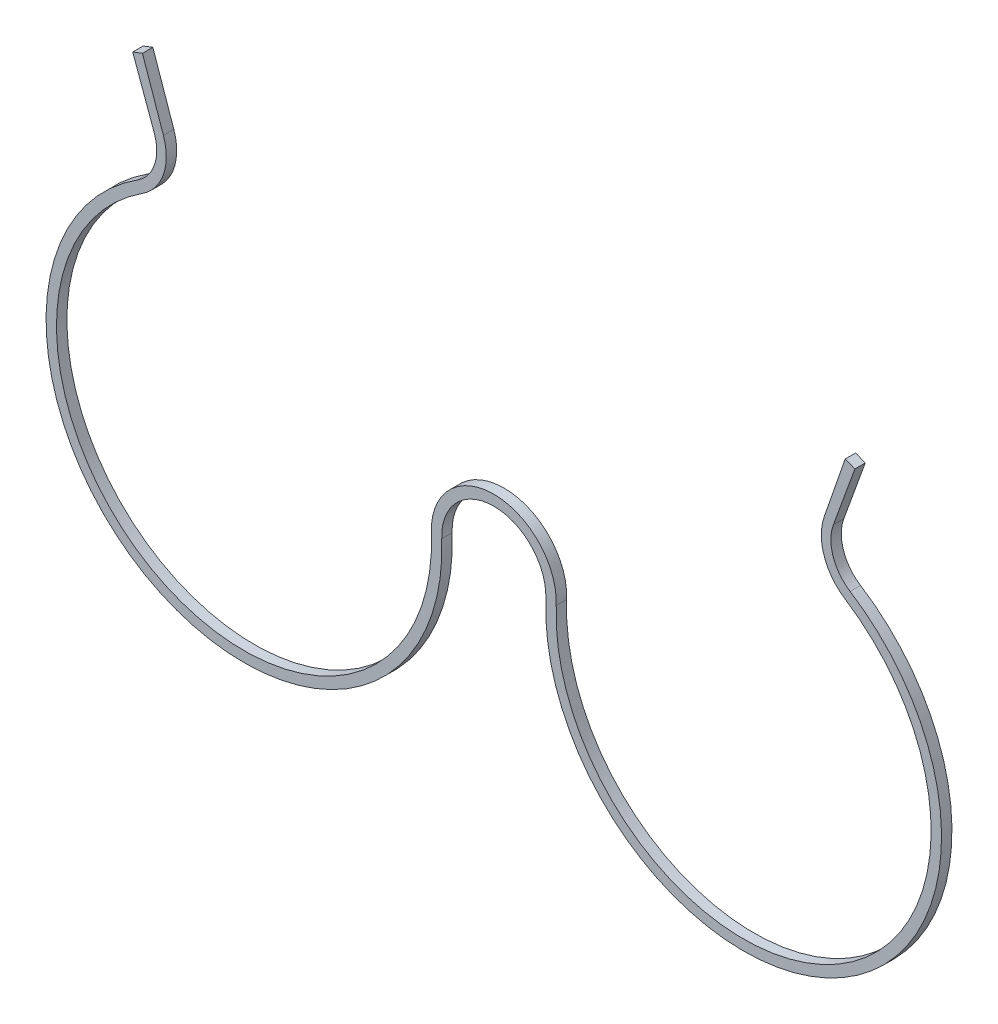
from build123d import *
from build123d.topology import SkipClean

# Parameters (mm, degrees)
BASE_EXTRUSION_DEPTH = 1


with BuildPart() as part:
    # Esquisse2 → Base-Extrusion (new body)
    with BuildSketch(Plane.XY):
        with BuildLine():
            Line((34.681264504, 26.422728636), (32.618025795, 20.754026872))
            ThreePointArc((32.618025795, 20.754026872), (32.588449466, 18.102034919), (34.224309969, 16.014477377))
            ThreePointArc((34.224309969, 16.014477377), (32.781477268, -16.8489067), (5.01650022, 0.791666667))
            ThreePointArc((5.01650022, 0.791666667), (3.629281566, 4.461093276), (0.020842383, 6))
            Line((0.020842383, 6), (0.020842383, 7))
            ThreePointArc((0.020842383, 7), (4.350969402, 5.153311931), (6.015631788, 0.75))
            ThreePointArc((6.015631788, 0.75), (32.285641023, -15.979616793), (33.750040286, 15.130654792))
            ThreePointArc((33.750040286, 15.130654792), (31.732063255, 17.702086165), (31.734019754, 20.970799485))
            Line((31.734019754, 20.970799485), (33.747574085, 26.781239692))
            ThreePointArc((33.747574085, 26.781239692), (34.215992075, 26.606080244), (34.681264504, 26.422728636))
        make_face()
    extrude(amount=-BASE_EXTRUSION_DEPTH)

    # Bossage-Symétrie1: part across plane


with BuildPart() as part_1:
    with SkipClean():  # the faces are left unmerged after this step: merging them gives an invalid solid
        add(part.part)
        add(part.part.mirror(Plane(origin=(0.020842383, 7, -1), x_dir=(0, 0, 1), z_dir=(-1, 0, 0))))


solid = part_1.part
